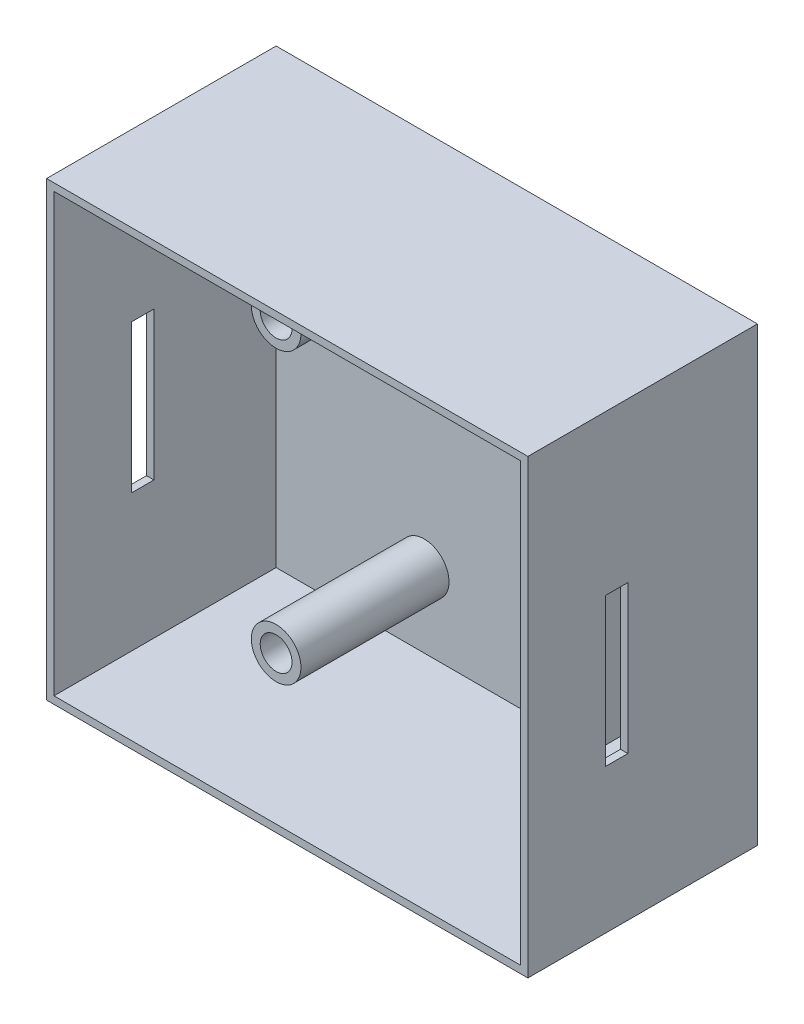
from build123d import *

# Parameters (mm, degrees)
CROQUIS1_W                 = 65
CROQUIS1_H                 = 61
SALIENTE_EXTRUIR1_DEPTH    = 30
CROQUIS1_7_R               = 3.35
CROQUIS1_7_R_2             = 2.15
SALIENTE_EXTRUIR2_DEPTH    = 20
SALIENTE_EXTRUIR2_2_DEPTH  = 20
SALIENTE_EXTRUIR4_DEPTH    = 10
CROQUIS2_W                 = 65
CROQUIS2_H                 = 61
SALIENTE_EXTRUIR5_DEPTH    = 1
CORTAR_EXTRUIR1_DEPTH      = 54.726157503
CORTAR_EXTRUIR1_DEPTH_BACK = 54.726157503
CROQUIS3_W                 = 3
CROQUIS3_H                 = 20
CORTAR_EXTRUIR2_START      = -40
CROQUIS5_R                 = 2.15
CORTAR_EXTRUIR2_DEPTH      = 40


with BuildPart() as part:
    # Croquis1 → Saliente-Extruir1 (new body)
    with BuildSketch(Plane.XY):
        Rectangle(CROQUIS1_W, CROQUIS1_H)
        Polygon((31.5, -29.5), (-31.5, -29.5), (-31.5, 29.5), (31.5, 29.5), (31.5, 24.5), (31.5, 23.5), (31.5, -22.5), (31.5, -23.5), align=None, mode=Mode.SUBTRACT)
    extrude(amount=SALIENTE_EXTRUIR1_DEPTH)

    # Croquis1<9> → Saliente-Extruir4 (add)
    with BuildSketch(Plane.XY):
        Polygon((17.5, -23.5), (31.5, -23.5), (31.5, -22.5), (18.5, -22.5), (18.5, 23.5), (31.5, 23.5), (31.5, 24.5), (17.5, 24.5), align=None)
    extrude(amount=SALIENTE_EXTRUIR4_DEPTH)



with BuildPart() as body_2:
    # Croquis1<7> → Saliente-Extruir2 (new body)
    with BuildSketch(Plane.XY):
        with Locations((-11.5, -19.5)):
            Circle(CROQUIS1_7_R)
        with Locations((-11.5, -19.5)):
            Circle(CROQUIS1_7_R_2, mode=Mode.SUBTRACT)
    extrude(amount=SALIENTE_EXTRUIR2_DEPTH)


with BuildPart() as body_3:
    # Croquis1<7> → Saliente-Extruir2 2 (new body)
    with BuildSketch(Plane.XY):
        with Locations((-11.5, 19.5)):
            Circle(CROQUIS1_7_R)
        with Locations((-11.5, 19.5)):
            Circle(CROQUIS1_7_R_2, mode=Mode.SUBTRACT)
    extrude(amount=SALIENTE_EXTRUIR2_2_DEPTH)


with BuildPart() as part_1:
    add(part.part)

    add(body_2.part)  # Saliente-Extruir5 merges body 2

    add(body_3.part)  # Saliente-Extruir5 merges body 3
    # Croquis2 → Saliente-Extruir5 (add)
    with BuildSketch(Plane(origin=(0, 0, 0), x_dir=(-1, 0, 0), z_dir=(0, 0, -1))):
        Rectangle(CROQUIS2_W, CROQUIS2_H)
    extrude(amount=SALIENTE_EXTRUIR5_DEPTH)

    # Croquis3 → Cortar-Extruir1 (cut, two sides: drawn at the far end of the back side and taken through both)
    with BuildSketch(Plane(origin=(0, 0, 0), x_dir=(0, 0, -1), z_dir=(1, 0, 0)).offset(-CORTAR_EXTRUIR1_DEPTH_BACK)):
        with Locations((-18, -1)):
            Rectangle(CROQUIS3_W, CROQUIS3_H)
    extrude(amount=CORTAR_EXTRUIR1_DEPTH + CORTAR_EXTRUIR1_DEPTH_BACK, mode=Mode.SUBTRACT)

    # Croquis5 → Cortar-Extruir2 (cut)
    with BuildSketch(Plane.XY.offset(20).offset(CORTAR_EXTRUIR2_START)):
        with Locations((-11.5, -19.5)):
            Circle(CROQUIS5_R)
        with Locations((-11.5, 19.5)):
            Circle(CROQUIS5_R)
    extrude(amount=CORTAR_EXTRUIR2_DEPTH, mode=Mode.SUBTRACT)


solid = part_1.part
